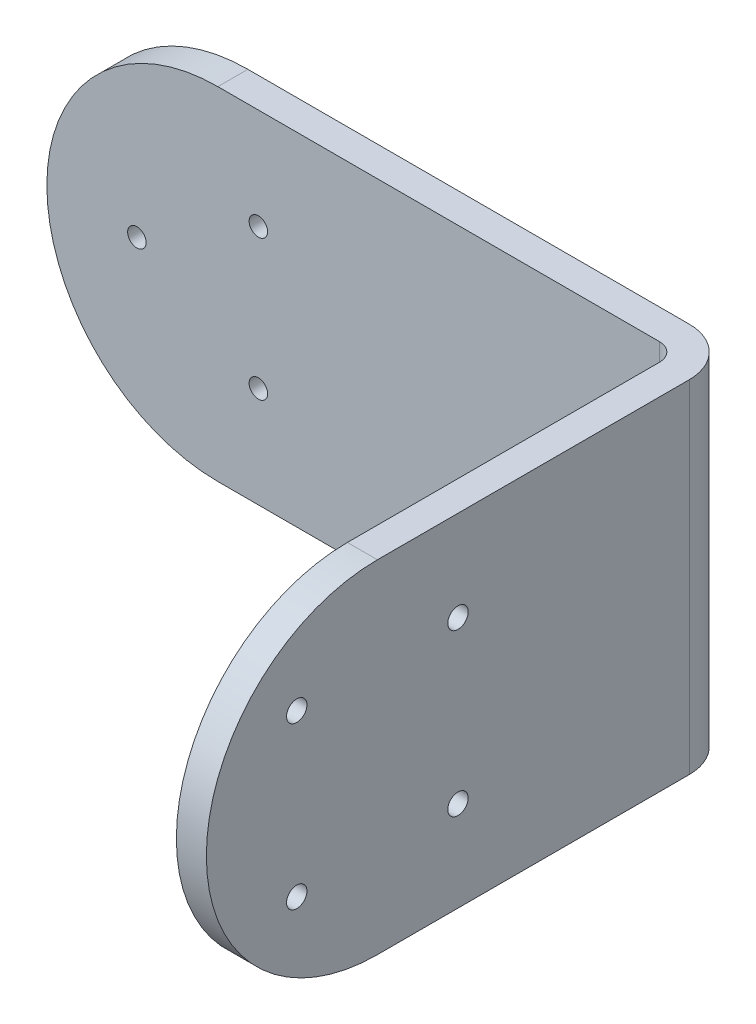
from build123d import *
from OCP.BRepFilletAPI import BRepFilletAPI_MakeFillet

# Parameters (mm, degrees)
SKETCH_1_R      = 1.54
EXTRUDE_1_DEPTH = 5
SKETCH_2_R      = 1.7
EXTRUDE_2_DEPTH = 5
FILLET_1_R1     = 3
FILLET_1_R2     = 8


with BuildPart() as part:
    # 草图1 → 凸台-拉伸1 (new body)
    with BuildSketch(Plane.XY):
        with BuildLine():
            Line((0, -28.5), (76.583465403, -28.5))
            Line((76.583465403, -28.5), (76.583465403, 28.5))
            Line((76.583465403, 28.5), (0, 28.5))
            ThreePointArc((0, 28.5), (-28.5, 0), (0, -28.5))
        make_face()
        with Locations((-13.5, 0)):
            Circle(SKETCH_1_R, mode=Mode.SUBTRACT)
        with Locations((6.75, 11.691342951)):
            Circle(SKETCH_1_R, mode=Mode.SUBTRACT)
        with Locations((6.75, -11.691342951)):
            Circle(SKETCH_1_R, mode=Mode.SUBTRACT)
    extrude(amount=EXTRUDE_1_DEPTH)

    # 草图2 → 凸台-拉伸2 (add)
    with BuildSketch(Plane(origin=(76.583465403, 0, 0), x_dir=(0, 0, -1), z_dir=(1, 0, 0))):
        with BuildLine():
            Line((0, -28.5), (0, 28.5))
            Line((0, 28.5), (-60, 28.5))
            ThreePointArc((-60, 28.5), (-88.5, 0), (-60, -28.5))
            Line((-60, -28.5), (0, -28.5))
        make_face()
        with Locations((-73.435028843, -13.435028843)):
            Circle(SKETCH_2_R, mode=Mode.SUBTRACT)
        with Locations((-73.435028843, 13.435028843)):
            Circle(SKETCH_2_R, mode=Mode.SUBTRACT)
        with Locations((-46.564971157, 13.435028843)):
            Circle(SKETCH_2_R, mode=Mode.SUBTRACT)
        with Locations((-46.564971157, -13.435028843)):
            Circle(SKETCH_2_R, mode=Mode.SUBTRACT)
    extrude(amount=EXTRUDE_2_DEPTH)

    # 圆角1: one fillet with a radius per group of edges: ONE call of the kernel's fillet builder (fillet() takes one radius for all edges)
    fillet_1_edges_1 = [part.edges().sort_by_distance(p)[0] for p in [
        (76.583465403, 0, 5),
    ]]
    fillet_1_edges_2 = [part.edges().sort_by_distance(p)[0] for p in [
        (81.583465403, 0, 0),
    ]]
    fillet_1 = BRepFilletAPI_MakeFillet(part.part.solid().wrapped)
    for e in fillet_1_edges_1:
        fillet_1.Add(FILLET_1_R1, e.wrapped)
    for e in fillet_1_edges_2:
        fillet_1.Add(FILLET_1_R2, e.wrapped)
    add(Compound.cast(fillet_1.Shape()), mode=Mode.REPLACE)


solid = part.part
